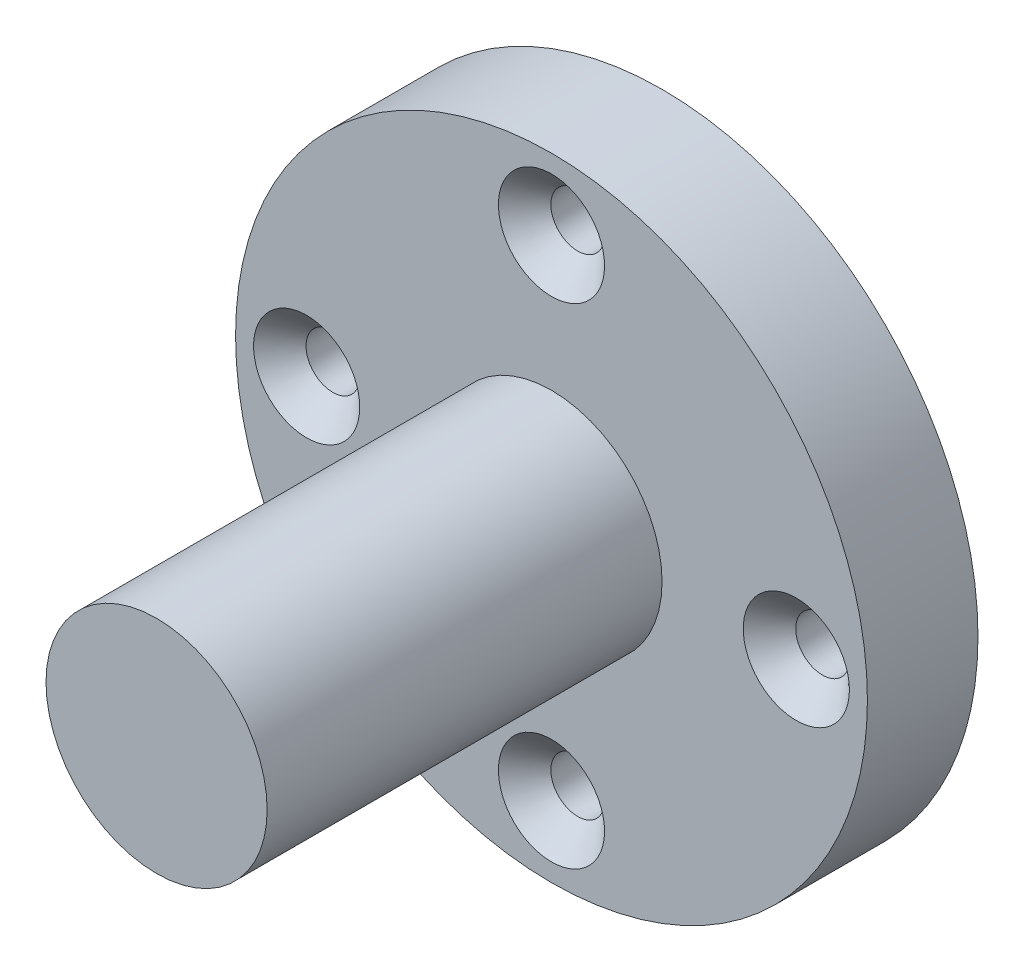
from build123d import *

# Parameters (mm, degrees)
CROQUIS1_R                                           = 20
SALIENTE_EXTRUIR1_DEPTH                              = 7
REFRENTADO_PARA_TORNILLO_TAP_N_CON_CABEZ_D           = 3.4
REFRENTADO_PARA_TORNILLO_TAP_N_CON_CABEZ_CSINK_D     = 6.72
REFRENTADO_PARA_TORNILLO_TAP_N_CON_CABEZ_CSINK_ANGLE = 90
TALADRO_DE_MARGEN_PARA_M31_D                         = 3.4
CROQUIS8_R                                           = 5
CORTAR_EXTRUIR1_DEPTH                                = 3
CROQUIS9_R                                           = 7
SALIENTE_EXTRUIR2_DEPTH                              = 25


with BuildPart() as part:
    # Croquis1 → Saliente-Extruir1 (new body)
    with BuildSketch(Plane.XY):
        Circle(CROQUIS1_R)
    extrude(amount=SALIENTE_EXTRUIR1_DEPTH)

    # Refrentado para tornillo tapón con cabeza plana de clavija de M31 (through all)
    with Locations(Plane.XY.offset(7)):
        with Locations((0, 15.5), (15.5, 0), (0, -15.5), (-15.5, 0)):
            CounterSinkHole(REFRENTADO_PARA_TORNILLO_TAP_N_CON_CABEZ_D / 2, REFRENTADO_PARA_TORNILLO_TAP_N_CON_CABEZ_CSINK_D / 2, counter_sink_angle=REFRENTADO_PARA_TORNILLO_TAP_N_CON_CABEZ_CSINK_ANGLE)

    # Taladro de margen para M31 (through all)
    with Locations(Plane.XY.offset(7)):
        with Locations((0, 0)):
            Hole(TALADRO_DE_MARGEN_PARA_M31_D / 2)

    # Croquis8 → Cortar-Extruir1 (cut)
    with BuildSketch(Plane(origin=(0, 0, 0), x_dir=(-1, 0, 0), z_dir=(0, 0, -1))):
        Circle(CROQUIS8_R)
    extrude(amount=-CORTAR_EXTRUIR1_DEPTH, mode=Mode.SUBTRACT)

    # Croquis9 → Saliente-Extruir2 (add)
    with BuildSketch(Plane.XY.offset(7)):
        Circle(CROQUIS9_R)
    extrude(amount=SALIENTE_EXTRUIR2_DEPTH)


solid = part.part
